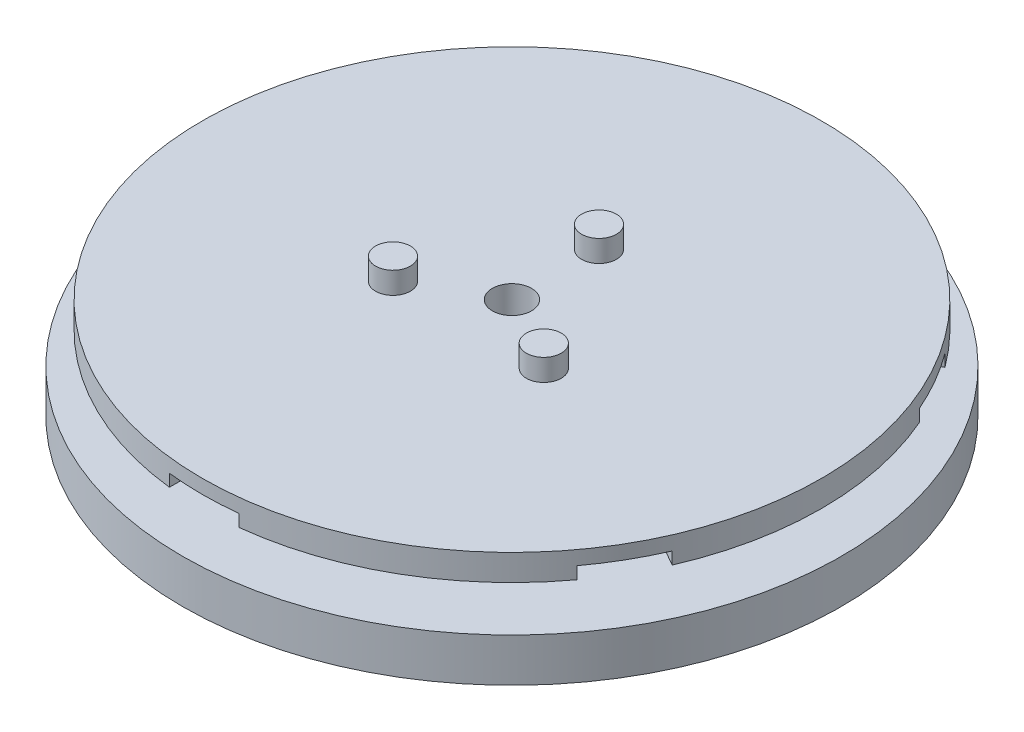
from build123d import *

# Parameters (mm, degrees)
SKETCH1_R                                         = 37.846
BOSS_EXTRUDE1_DEPTH                               = 5
SKETCH2_R                                         = 24.846
BOSS_EXTRUDE2_DEPTH                               = 5
SKETCH3_R                                         = 35.56
BOSS_EXTRUDE3_DEPTH                               = 1.6
SKETCH4_R                                         = 2
BOSS_EXTRUDE4_DEPTH                               = 2.5
CIRPATTERN1_COUNT                                 = 3
CSK_FOR_8_FLAT_HEAD_MACHINE_SCREW_100_D           = 4.4958
CSK_FOR_8_FLAT_HEAD_MACHINE_SCREW_100_CSINK_D     = 8.4328
CSK_FOR_8_FLAT_HEAD_MACHINE_SCREW_100_CSINK_ANGLE = 100
BOSS_EXTRUDE5_START                               = -3
SKETCH7_R                                         = 35.56
BOSS_EXTRUDE5_DEPTH                               = 3
CUT_EXTRUDE1_START                                = -1.6
SKETCH8_W                                         = 8
SKETCH8_H                                         = 12
CUT_EXTRUDE1_DEPTH                                = 1.4
CIRPATTERN2_COUNT                                 = 6
SKETCH9_R                                         = 2.2479
CUT_EXTRUDE2_DEPTH                                = 55.208850126


with BuildPart() as part:
    # Sketch1 → Boss-Extrude1 (new body)
    with BuildSketch(Plane(origin=(0, 0, 0), x_dir=(1, 0, 0), z_dir=(0, 1, 0))):
        with Locations(Location((0, 0, 0), (0, 0, 270))):
            Circle(SKETCH1_R)
    extrude(amount=BOSS_EXTRUDE1_DEPTH)

    # Sketch2 → Boss-Extrude2 (add)
    with BuildSketch(Plane(origin=(0, 5, 0), x_dir=(1, 0, 0), z_dir=(0, 1, 0))):
        with Locations(Location((0, 0, 0), (0, 0, 270))):
            Circle(SKETCH2_R)
    extrude(amount=BOSS_EXTRUDE2_DEPTH)

    # Sketch3 → Boss-Extrude3 (add)
    with BuildSketch(Plane(origin=(0, 10, 0), x_dir=(1, 0, 0), z_dir=(0, 1, 0))):
        with Locations(Location((0, 0, 0), (0, 0, 270))):
            Circle(SKETCH3_R)
    extrude(amount=BOSS_EXTRUDE3_DEPTH)

    # Sketch4 → Boss-Extrude4 (add)
    with BuildSketch(Plane(origin=(0, 11.6, 0), x_dir=(1, 0, 0), z_dir=(0, 1, 0))):
        with Locations(Location((0, 10, 0), (0, 0, 270))):
            Circle(SKETCH4_R)
    boss_extrude4 = extrude(amount=BOSS_EXTRUDE4_DEPTH)

    # CirPattern1: Boss-Extrude4 ×3 about axis
    cirpattern1_axis = Axis((0, 0, 0), (0, 1, 0))
    for i in range(1, CIRPATTERN1_COUNT):
        add(boss_extrude4.rotate(cirpattern1_axis, i * 360 / CIRPATTERN1_COUNT))

    # CSK for #8 Flat Head Machine Screw (100)1 (through all)
    with Locations(Plane(origin=(0, 0, 0), x_dir=(-1, 0, 0), z_dir=(0, -1, 0))):
        with Locations((0, 0)):
            CounterSinkHole(CSK_FOR_8_FLAT_HEAD_MACHINE_SCREW_100_D / 2, CSK_FOR_8_FLAT_HEAD_MACHINE_SCREW_100_CSINK_D / 2, counter_sink_angle=CSK_FOR_8_FLAT_HEAD_MACHINE_SCREW_100_CSINK_ANGLE)

    # Sketch7 → Boss-Extrude5 (add)
    with BuildSketch(Plane(origin=(0, 11.6, 0), x_dir=(1, 0, 0), z_dir=(0, 1, 0)).offset(BOSS_EXTRUDE5_START)):
        with Locations(Location((0, 0, 0), (0, 0, 270))):
            Circle(SKETCH7_R)
    extrude(amount=BOSS_EXTRUDE5_DEPTH)

    # Sketch8 → Cut-Extrude1 (cut)
    with BuildSketch(Plane(origin=(0, 11.6, 0), x_dir=(1, 0, 0), z_dir=(0, 1, 0)).offset(CUT_EXTRUDE1_START)):
        with Locations((0, 29.56)):
            Rectangle(SKETCH8_W, SKETCH8_H)
    cut_extrude1 = extrude(amount=-CUT_EXTRUDE1_DEPTH, mode=Mode.SUBTRACT)

    # CirPattern2: Cut-Extrude1 ×6 about axis
    cirpattern2_axis = Axis((0, 0, 0), (0, 1, 0))
    for i in range(1, CIRPATTERN2_COUNT):
        add(cut_extrude1.rotate(cirpattern2_axis, i * 360 / CIRPATTERN2_COUNT), mode=Mode.SUBTRACT)

    # Sketch9 → Cut-Extrude2 (cut, through all)
    with BuildSketch(Plane.XZ.offset(-8.6)):
        with Locations(Location((0, 0, 0), (0, 0, 270))):
            Circle(SKETCH9_R)
    extrude(amount=-CUT_EXTRUDE2_DEPTH, mode=Mode.SUBTRACT)


solid = part.part
